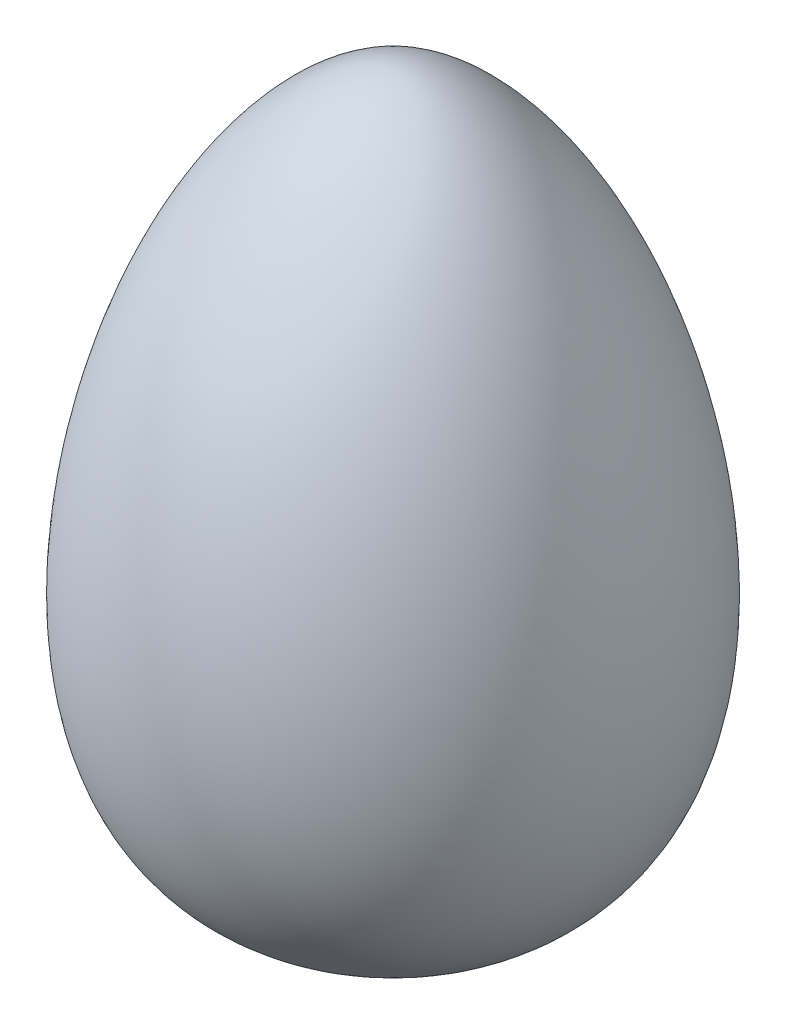
from build123d import *


with BuildPart() as part:
    # Sketch1 → Revolve1 (revolve)
    with BuildSketch(Plane.XY):
        with BuildLine():
            Line((0, 31.5), (0, -31.5))
            add(Edge.make_bspline(
                [(0, 31.5), (-6.45, 31.5), (-17.314135807, 19.745359709), (-23.303053736, -13.108303898), (-18.897983539, -31.776076335), (0, -31.5)],
                knots=[0, 0, 0, 0, 0.524773134, 0.624773134, 1, 1, 1, 1], degree=3))
        make_face()
    revolve(axis=Axis((0, 31.5, 0), (0, -1, 0)))


solid = part.part
